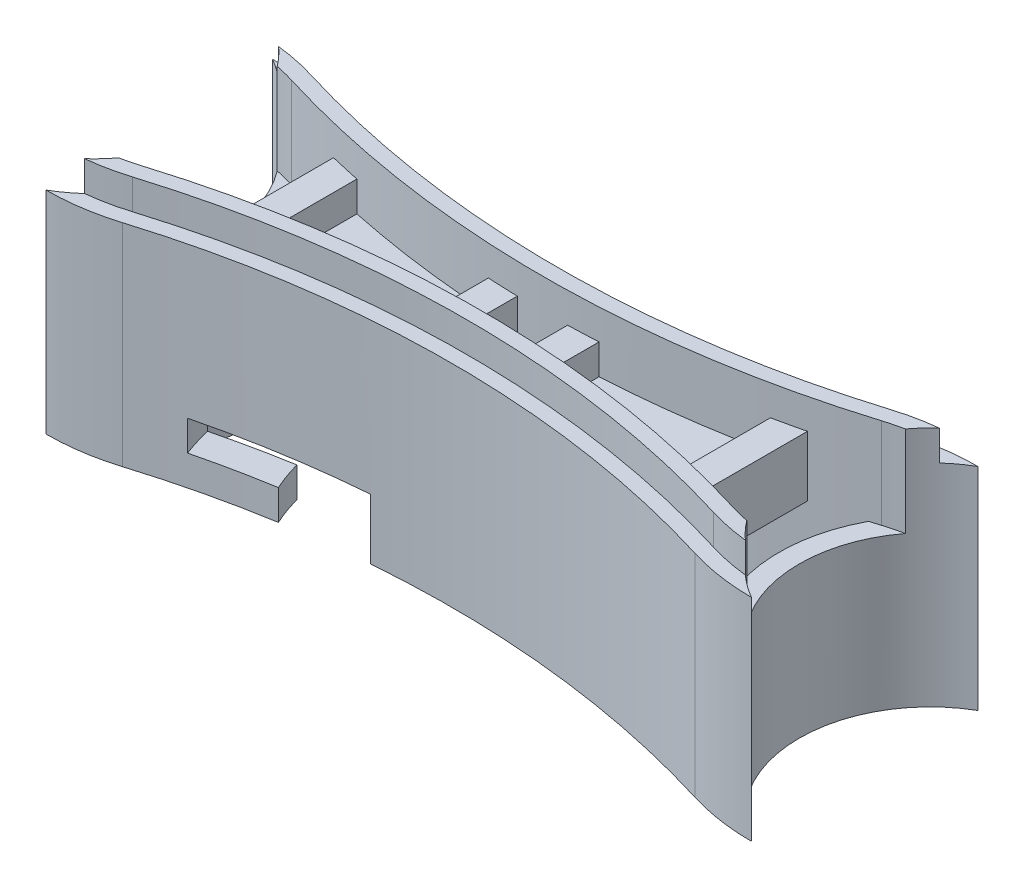
from build123d import *
from build123d.topology import SkipClean

# Parameters (mm, degrees)
BOSS_EXTRUDE1_DEPTH  = 3
BOSS_EXTRUDE2_DEPTH  = 3
CUT_EXTRUDE1_START   = -6
SKETCH5_R            = 13
CUT_EXTRUDE1_DEPTH   = 6
BOSS_EXTRUDE3_START  = 3
BOSS_EXTRUDE3_DEPTH  = 3
CUT_EXTRUDE2_START   = -3
CUT_EXTRUDE2_DEPTH   = 3
BOSS_EXTRUDE5_DEPTH  = 3
BOSS_EXTRUDE6_START  = 9
BOSS_EXTRUDE6_DEPTH  = 9
CUT_EXTRUDE3_START   = -9
CUT_EXTRUDE3_DEPTH   = 9
BOSS_EXTRUDE7_START  = 3
BOSS_EXTRUDE7_DEPTH  = 3
BOSS_EXTRUDE9_START  = 3
BOSS_EXTRUDE9_DEPTH  = 3
CUT_EXTRUDE4_DEPTH   = 3
BOSS_EXTRUDE10_DEPTH = 6
BOSS_EXTRUDE11_DEPTH = 6
CUT_EXTRUDE11_START  = -3
CUT_EXTRUDE11_DEPTH  = 3


with BuildPart() as part:
    # Sketch1 → Boss-Extrude1 (new body)
    with BuildSketch(Plane(origin=(0, 0, 0), x_dir=(1, 0, 0), z_dir=(0, 1, 0))):
        with BuildLine():
            ThreePointArc((-13.763919318, 73.266859581), (-33.263919318, 62.008529332), (-13.763919318, 50.750199082))
            ThreePointArc((-13.763919318, 50.750199082), (-9.005589068, 55.508529332), (-7.263919318, 62.008529332))
            ThreePointArc((-7.263919318, 62.008529332), (-9.005589068, 68.508529332), (-13.763919318, 73.266859581))
        make_face()
        with BuildLine():
            ThreePointArc((-13.763919318, 73.266859581), (-10.422992686, 73.017623928), (-7.156027114, 72.27543452))
            ThreePointArc((-7.156027114, 72.27543452), (21.283086066, 68.008529332), (49.722199247, 72.27543452))
            ThreePointArc((49.722199247, 72.27543452), (52.989164819, 73.017623928), (56.33009145, 73.266859581))
            ThreePointArc((56.33009145, 73.266859581), (49.83009145, 62.008529332), (56.33009145, 50.750199082))
            ThreePointArc((56.33009145, 50.750199082), (52.989164819, 50.999434735), (49.722199247, 51.741624144))
            ThreePointArc((49.722199247, 51.741624144), (21.283086066, 56.008529332), (-7.156027114, 51.741624144))
            ThreePointArc((-7.156027114, 51.741624144), (-10.422992686, 50.999434735), (-13.763919318, 50.750199082))
            ThreePointArc((-13.763919318, 50.750199082), (-7.263919318, 62.008529332), (-13.763919318, 73.266859581))
        make_face()
        with BuildLine():
            ThreePointArc((56.33009145, 73.266859581), (49.83009145, 62.008529332), (56.33009145, 50.750199082))
            ThreePointArc((56.33009145, 50.750199082), (69.33009145, 50.750199082), (75.83009145, 62.008529332))
            ThreePointArc((75.83009145, 62.008529332), (69.33009145, 73.266859581), (56.33009145, 73.266859581))
        make_face()
    extrude(amount=BOSS_EXTRUDE1_DEPTH)

    # Sketch3 → Boss-Extrude2 (add)
    with BuildSketch(Plane(origin=(0, 3, 0), x_dir=(1, 0, 0), z_dir=(0, 1, 0))):
        with BuildLine():
            ThreePointArc((-14.172730478, 71.762883155), (-31.763919318, 62.008529332), (-14.172730478, 52.254175508))
            ThreePointArc((-14.172730478, 52.254175508), (-10.84785642, 52.453484177), (-7.596227307, 53.175578044))
            ThreePointArc((-7.596227307, 53.175578044), (21.283086066, 57.508529332), (50.16239944, 53.175578044))
            ThreePointArc((50.16239944, 53.175578044), (53.414028553, 52.453484177), (56.73890261, 52.254175508))
            ThreePointArc((56.73890261, 52.254175508), (74.33009145, 62.008529332), (56.73890261, 71.762883155))
            ThreePointArc((56.73890261, 71.762883155), (53.414028553, 71.563574486), (50.16239944, 70.841480619))
            ThreePointArc((50.16239944, 70.841480619), (21.283086066, 66.508529332), (-7.596227307, 70.841480619))
            ThreePointArc((-7.596227307, 70.841480619), (-10.84785642, 71.563574486), (-14.172730478, 71.762883155))
        make_face()
        with BuildLine():
            ThreePointArc((-14.598703474, 70.248998338), (-30.263919318, 62.008529332), (-14.598703474, 53.768060325))
            ThreePointArc((-14.598703474, 53.768060325), (-11.28164905, 53.908699252), (-8.036427501, 54.609531945))
            ThreePointArc((-8.036427501, 54.609531945), (21.283086066, 59.008529332), (50.602599633, 54.609531945))
            ThreePointArc((50.602599633, 54.609531945), (53.847821182, 53.908699252), (57.164875607, 53.768060325))
            ThreePointArc((57.164875607, 53.768060325), (72.83009145, 62.008529332), (57.164875607, 70.248998338))
            ThreePointArc((57.164875607, 70.248998338), (53.847821182, 70.108359411), (50.602599633, 69.407526718))
            ThreePointArc((50.602599633, 69.407526718), (21.283086066, 65.008529332), (-8.036427501, 69.407526718))
            ThreePointArc((-8.036427501, 69.407526718), (-11.28164905, 70.108359411), (-14.598703474, 70.248998338))
        make_face(mode=Mode.SUBTRACT)
    extrude(amount=BOSS_EXTRUDE2_DEPTH)

    # Sketch5 → Cut-Extrude1 (cut)
    with BuildSketch(Plane(origin=(0, 6, 0), x_dir=(1, 0, 0), z_dir=(0, 1, 0)).offset(CUT_EXTRUDE1_START)):
        with Locations((-20.263919318, 62.008529332)):
            Circle(SKETCH5_R)
        with Locations((62.83009145, 62.008529332)):
            Circle(SKETCH5_R)
    extrude(amount=CUT_EXTRUDE1_DEPTH, mode=Mode.SUBTRACT)

    # Sketch6 → Boss-Extrude3 (add)
    with BuildSketch(Plane.XZ.offset(BOSS_EXTRUDE3_START)):
        with BuildLine():
            ThreePointArc((-7.156027114, -51.741624144), (-10.422992686, -50.999434735), (-13.763919318, -50.750199082))
            ThreePointArc((-13.763919318, -50.750199082), (-7.263919318, -62.008529332), (-13.763919318, -73.266859581))
            ThreePointArc((-13.763919318, -73.266859581), (-10.422992686, -73.017623928), (-7.156027114, -72.27543452))
            ThreePointArc((-7.156027114, -72.27543452), (21.283086066, -68.008529332), (49.722199247, -72.27543452))
            ThreePointArc((49.722199247, -72.27543452), (52.989164819, -73.017623928), (56.33009145, -73.266859581))
            ThreePointArc((56.33009145, -73.266859581), (49.83009145, -62.008529332), (56.33009145, -50.750199082))
            ThreePointArc((56.33009145, -50.750199082), (52.989164819, -50.999434735), (49.722199247, -51.741624144))
            ThreePointArc((49.722199247, -51.741624144), (21.283086066, -56.008529332), (-7.156027114, -51.741624144))
        make_face()
    extrude(amount=-BOSS_EXTRUDE3_DEPTH)

    # Sketch7 → Cut-Extrude2 (cut)
    with BuildSketch(Plane(origin=(0, 3, 0), x_dir=(1, 0, 0), z_dir=(0, 1, 0)).offset(CUT_EXTRUDE2_START)):
        with BuildLine():
            ThreePointArc((-9.921640975, 54.132154614), (-7.263919318, 62.008529332), (-9.921640975, 69.884904049))
            ThreePointArc((-9.921640975, 69.884904049), (-8.973084578, 69.669711219), (-8.036427501, 69.407526718))
            ThreePointArc((-8.036427501, 69.407526718), (21.283086066, 65.008529332), (50.602599633, 69.407526718))
            ThreePointArc((50.602599633, 69.407526718), (51.53925671, 69.669711219), (52.487813107, 69.884904049))
            ThreePointArc((52.487813107, 69.884904049), (49.83009145, 62.008529332), (52.487813107, 54.132154614))
            ThreePointArc((52.487813107, 54.132154614), (51.53925671, 54.347347444), (50.602599633, 54.609531945))
            ThreePointArc((50.602599633, 54.609531945), (21.283086066, 59.008529332), (-8.036427501, 54.609531945))
            ThreePointArc((-8.036427501, 54.609531945), (-8.973084578, 54.347347444), (-9.921640975, 54.132154614))
        make_face()
    extrude(amount=CUT_EXTRUDE2_DEPTH, mode=Mode.SUBTRACT)

    # Sketch8 → Boss-Extrude5 (add)
    with BuildSketch(Plane(origin=(0, 0, 0), x_dir=(1, 0, 0), z_dir=(0, 1, 0))):
        with BuildLine():
            ThreePointArc((0.736080682, 67.144209105), (-0.766531901, 67.472083585), (-2.263919318, 67.823049647))
            Line((-2.263919318, 67.823049647), (-2.263919318, 56.194009017))
            ThreePointArc((-2.263919318, 56.194009017), (-0.766531901, 56.544975078), (0.736080682, 56.872849558))
            Line((0.736080682, 56.872849558), (0.736080682, 67.144209105))
        make_face()
        with BuildLine():
            ThreePointArc((18.783086066, 65.039813184), (17.282634431, 65.088653668), (15.783086066, 65.160034347))
            Line((15.783086066, 65.160034347), (15.783086066, 58.857024316))
            ThreePointArc((15.783086066, 58.857024316), (17.282634431, 58.928404995), (18.783086066, 58.977245479))
            Line((18.783086066, 58.977245479), (18.783086066, 65.039813184))
        make_face()
        with BuildLine():
            ThreePointArc((26.783086066, 65.160034347), (25.283537701, 65.088653668), (23.783086066, 65.039813184))
            Line((23.783086066, 65.039813184), (23.783086066, 58.977245479))
            ThreePointArc((23.783086066, 58.977245479), (25.283537701, 58.928404995), (26.783086066, 58.857024316))
            Line((26.783086066, 58.857024316), (26.783086066, 65.160034347))
        make_face()
        with BuildLine():
            ThreePointArc((44.83009145, 67.823049647), (43.332704034, 67.472083585), (41.83009145, 67.144209105))
            Line((41.83009145, 67.144209105), (41.83009145, 56.872849558))
            ThreePointArc((41.83009145, 56.872849558), (43.332704034, 56.544975078), (44.83009145, 56.194009017))
            Line((44.83009145, 56.194009017), (44.83009145, 67.823049647))
        make_face()
    extrude(amount=BOSS_EXTRUDE5_DEPTH)

    # Sketch9 → Boss-Extrude6 (add)
    with SkipClean():  # the faces are left unmerged after this step: merging them gives an invalid solid
        with BuildSketch(Plane.XZ.offset(3).offset(BOSS_EXTRUDE6_START)):
            with BuildLine():
                ThreePointArc((-7.156027114, -51.741624144), (21.283086066, -56.008529332), (49.722199247, -51.741624144))
                ThreePointArc((49.722199247, -51.741624144), (52.989164819, -50.999434735), (56.33009145, -50.750199082))
                ThreePointArc((56.33009145, -50.750199082), (49.83009145, -62.008529332), (56.33009145, -73.266859581))
                ThreePointArc((56.33009145, -73.266859581), (52.989164819, -73.017623928), (49.722199247, -72.27543452))
                ThreePointArc((49.722199247, -72.27543452), (21.283086066, -68.008529332), (-7.156027114, -72.27543452))
                ThreePointArc((-7.156027114, -72.27543452), (-10.422992686, -73.017623928), (-13.763919318, -73.266859581))
                ThreePointArc((-13.763919318, -73.266859581), (-7.263919318, -62.008529332), (-13.763919318, -50.750199082))
                ThreePointArc((-13.763919318, -50.750199082), (-10.422992686, -50.999434735), (-7.156027114, -51.741624144))
            make_face()
            with BuildLine():
                ThreePointArc((-5.746204667, -55.282760877), (21.283086066, -59.008529332), (48.312376799, -55.282760877))
                ThreePointArc((48.312376799, -55.282760877), (46.83009145, -62.008529332), (48.312376799, -68.734297787))
                ThreePointArc((48.312376799, -68.734297787), (21.283086066, -65.008529332), (-5.746204667, -68.734297787))
                ThreePointArc((-5.746204667, -68.734297787), (-4.263919318, -62.008529332), (-5.746204667, -55.282760877))
            make_face(mode=Mode.SUBTRACT)
        extrude(amount=-BOSS_EXTRUDE6_DEPTH)

    # Sketch10 → Cut-Extrude3 (cut)
    with SkipClean():  # the faces are left unmerged after this step: merging them gives an invalid solid
        with BuildSketch(Plane(origin=(0, 0, 0), x_dir=(1, 0, 0), z_dir=(0, 1, 0)).offset(CUT_EXTRUDE3_START)):
            with BuildLine():
                Line((18.783086066, 65.039813184), (18.783086066, 58.977245479))
                ThreePointArc((18.783086066, 58.977245479), (21.283086066, 59.008529332), (23.783086066, 58.977245479))
                Line((23.783086066, 58.977245479), (23.783086066, 65.039813184))
                ThreePointArc((23.783086066, 65.039813184), (21.283086066, 65.008529332), (18.783086066, 65.039813184))
            make_face()
            with BuildLine():
                Line((44.83009145, 67.823049647), (44.83009145, 56.194009017))
                ThreePointArc((44.83009145, 56.194009017), (47.728215077, 55.445013132), (50.602599633, 54.609531945))
                ThreePointArc((50.602599633, 54.609531945), (51.53925671, 54.347347444), (52.487813107, 54.132154614))
                ThreePointArc((52.487813107, 54.132154614), (49.83009145, 62.008529332), (52.487813107, 69.884904049))
                ThreePointArc((52.487813107, 69.884904049), (51.53925671, 69.669711219), (50.602599633, 69.407526718))
                ThreePointArc((50.602599633, 69.407526718), (47.728215077, 68.572045531), (44.83009145, 67.823049647))
            make_face()
            with BuildLine():
                Line((-2.263919318, 56.194009017), (-2.263919318, 67.823049647))
                ThreePointArc((-2.263919318, 67.823049647), (-5.162042944, 68.572045531), (-8.036427501, 69.407526718))
                ThreePointArc((-8.036427501, 69.407526718), (-8.973084578, 69.669711219), (-9.921640975, 69.884904049))
                ThreePointArc((-9.921640975, 69.884904049), (-7.263919318, 62.008529332), (-9.921640975, 54.132154614))
                ThreePointArc((-9.921640975, 54.132154614), (-8.973084578, 54.347347444), (-8.036427501, 54.609531945))
                ThreePointArc((-8.036427501, 54.609531945), (-5.162042944, 55.445013132), (-2.263919318, 56.194009017))
            make_face()
        extrude(amount=CUT_EXTRUDE3_DEPTH, mode=Mode.SUBTRACT)

    # Sketch11 → Boss-Extrude7 (add)
    with SkipClean():  # the faces are left unmerged after this step: merging them gives an invalid solid
        with BuildSketch(Plane.XZ.offset(12).offset(BOSS_EXTRUDE7_START)):
            with BuildLine():
                ThreePointArc((56.33009145, -50.750199082), (52.989164819, -50.999434735), (49.722199247, -51.741624144))
                ThreePointArc((49.722199247, -51.741624144), (31.811586967, -55.434897445), (13.526037949, -55.697570252))
                ThreePointArc((13.526037949, -55.697570252), (12.590934614, -57.064188816), (11.894175682, -58.56638439))
                ThreePointArc((11.894175682, -58.56638439), (30.254780475, -58.604884532), (48.312376799, -55.282760877))
                ThreePointArc((48.312376799, -55.282760877), (46.83009145, -62.008529332), (48.312376799, -68.734297787))
                ThreePointArc((48.312376799, -68.734297787), (46.935876311, -68.358054802), (45.55414243, -68.001510476))
                ThreePointArc((45.55414243, -68.001510476), (45.150090936, -69.449367895), (44.659753587, -70.870324614))
                ThreePointArc((44.659753587, -70.870324614), (47.200500402, -71.538565767), (49.722199247, -72.27543452))
                ThreePointArc((49.722199247, -72.27543452), (52.989164819, -73.017623928), (56.33009145, -73.266859581))
                ThreePointArc((56.33009145, -73.266859581), (49.83009145, -62.008529332), (56.33009145, -50.750199082))
            make_face()
            with BuildLine():
                ThreePointArc((29.040134183, -68.319488412), (29.975237519, -66.952869847), (30.67199645, -65.450674273))
                ThreePointArc((30.67199645, -65.450674273), (12.311391658, -65.412174131), (-5.746204667, -68.734297787))
                ThreePointArc((-5.746204667, -68.734297787), (-4.263919318, -62.008529332), (-5.746204667, -55.282760877))
                ThreePointArc((-5.746204667, -55.282760877), (-4.369704179, -55.659003861), (-2.987970297, -56.015548187))
                ThreePointArc((-2.987970297, -56.015548187), (-2.583918804, -54.567690768), (-2.093581454, -53.146734049))
                ThreePointArc((-2.093581454, -53.146734049), (-4.63432827, -52.478492896), (-7.156027114, -51.741624144))
                ThreePointArc((-7.156027114, -51.741624144), (-10.422992686, -50.999434735), (-13.763919318, -50.750199082))
                ThreePointArc((-13.763919318, -50.750199082), (-7.263919318, -62.008529332), (-13.763919318, -73.266859581))
                ThreePointArc((-13.763919318, -73.266859581), (-10.422992686, -73.017623928), (-7.156027114, -72.27543452))
                ThreePointArc((-7.156027114, -72.27543452), (10.754585165, -68.582161219), (29.040134183, -68.319488412))
            make_face()
        extrude(amount=-BOSS_EXTRUDE7_DEPTH)

    # Sketch13 → Boss-Extrude9 (add)
    with SkipClean():  # the faces are left unmerged after this step: merging them gives an invalid solid
        with BuildSketch(Plane.XZ.offset(15).offset(BOSS_EXTRUDE9_START)):
            with BuildLine():
                ThreePointArc((56.33009145, -50.750199082), (49.83009145, -62.008529332), (56.33009145, -73.266859581))
                ThreePointArc((56.33009145, -73.266859581), (52.989164819, -73.017623928), (49.722199247, -72.27543452))
                ThreePointArc((49.722199247, -72.27543452), (21.283086066, -68.008529332), (-7.156027114, -72.27543452))
                ThreePointArc((-7.156027114, -72.27543452), (-10.422992686, -73.017623928), (-13.763919318, -73.266859581))
                ThreePointArc((-13.763919318, -73.266859581), (-7.263919318, -62.008529332), (-13.763919318, -50.750199082))
                ThreePointArc((-13.763919318, -50.750199082), (-10.422992686, -50.999434735), (-7.156027114, -51.741624144))
                ThreePointArc((-7.156027114, -51.741624144), (21.283086066, -56.008529332), (49.722199247, -51.741624144))
                ThreePointArc((49.722199247, -51.741624144), (52.989164819, -50.999434735), (56.33009145, -50.750199082))
            make_face()
            with BuildLine():
                ThreePointArc((48.312376799, -68.734297787), (21.283086066, -65.008529332), (-5.746204667, -68.734297787))
                ThreePointArc((-5.746204667, -68.734297787), (-4.263919318, -62.008529332), (-5.746204667, -55.282760877))
                ThreePointArc((-5.746204667, -55.282760877), (21.283086066, -59.008529332), (48.312376799, -55.282760877))
                ThreePointArc((48.312376799, -55.282760877), (46.83009145, -62.008529332), (48.312376799, -68.734297787))
            make_face(mode=Mode.SUBTRACT)
        extrude(amount=-BOSS_EXTRUDE9_DEPTH)

    # Sketch15 → Cut-Extrude4 (cut)
    with SkipClean():  # the faces are left unmerged after this step: merging them gives an invalid solid
        with BuildSketch(Plane.XZ.offset(18)):
            with BuildLine():
                ThreePointArc((29.040134183, -68.319488412), (33.121573027, -68.734359133), (37.181795412, -69.321602634))
                ThreePointArc((37.181795412, -69.321602634), (37.758137324, -67.909604324), (38.209354423, -66.452788496))
                ThreePointArc((38.209354423, -66.452788496), (34.450212414, -65.879999427), (30.67199645, -65.450674273))
                ThreePointArc((30.67199645, -65.450674273), (29.975237519, -66.952869847), (29.040134183, -68.319488412))
            make_face()
            with BuildLine():
                ThreePointArc((5.38437672, -54.695456029), (4.808034809, -56.107454339), (4.35681771, -57.564270167))
                ThreePointArc((4.35681771, -57.564270167), (8.115959718, -58.137059237), (11.894175682, -58.56638439))
                ThreePointArc((11.894175682, -58.56638439), (12.590934614, -57.064188816), (13.526037949, -55.697570252))
                ThreePointArc((13.526037949, -55.697570252), (9.444599106, -55.282699531), (5.38437672, -54.695456029))
            make_face()
        extrude(amount=-CUT_EXTRUDE4_DEPTH, mode=Mode.SUBTRACT)

    # Sketch16 → Boss-Extrude10 (add)
    with SkipClean():  # the faces are left unmerged after this step: merging them gives an invalid solid
        with BuildSketch(Plane.XZ.offset(18)):
            with BuildLine():
                ThreePointArc((23.783086066, -58.977245479), (21.283086066, -59.008529332), (18.783086066, -58.977245479))
                Line((18.783086066, -58.977245479), (18.783086066, -65.039813184))
                ThreePointArc((18.783086066, -65.039813184), (21.283086066, -65.008529332), (23.783086066, -65.039813184))
                Line((23.783086066, -65.039813184), (23.783086066, -58.977245479))
            make_face()
        extrude(amount=-BOSS_EXTRUDE10_DEPTH)

    # Sketch18 → Boss-Extrude11 (add)
    with SkipClean():  # the faces are left unmerged after this step: merging them gives an invalid solid
        with BuildSketch(Plane(origin=(0, -9, 0), x_dir=(1, 0, 0), z_dir=(0, 1, 0))):
            with BuildLine():
                ThreePointArc((50.602599633, 54.609531945), (49.459499, 54.952986792), (48.312376799, 55.282760877))
                ThreePointArc((48.312376799, 55.282760877), (46.83009145, 62.008529332), (48.312376799, 68.734297787))
                ThreePointArc((48.312376799, 68.734297787), (49.459499, 69.064071871), (50.602599633, 69.407526718))
                ThreePointArc((50.602599633, 69.407526718), (51.53925671, 69.669711219), (52.487813107, 69.884904049))
                ThreePointArc((52.487813107, 69.884904049), (49.83009145, 62.008529332), (52.487813107, 54.132154614))
                ThreePointArc((52.487813107, 54.132154614), (51.53925671, 54.347347444), (50.602599633, 54.609531945))
            make_face()
            with BuildLine():
                ThreePointArc((-8.036427501, 69.407526718), (-6.893326867, 69.064071871), (-5.746204667, 68.734297787))
                ThreePointArc((-5.746204667, 68.734297787), (-4.263919318, 62.008529332), (-5.746204667, 55.282760877))
                ThreePointArc((-5.746204667, 55.282760877), (-6.893326867, 54.952986792), (-8.036427501, 54.609531945))
                ThreePointArc((-8.036427501, 54.609531945), (-8.973084578, 54.347347444), (-9.921640975, 54.132154614))
                ThreePointArc((-9.921640975, 54.132154614), (-7.263919318, 62.008529332), (-9.921640975, 69.884904049))
                ThreePointArc((-9.921640975, 69.884904049), (-8.973084578, 69.669711219), (-8.036427501, 69.407526718))
            make_face()
        extrude(amount=BOSS_EXTRUDE11_DEPTH)

    # Sketch21 → Cut-Extrude11 (cut)
    with SkipClean():  # the faces are left unmerged after this step: merging them gives an invalid solid
        with BuildSketch(Plane(origin=(0, -3, 0), x_dir=(1, 0, 0), z_dir=(0, 1, 0)).offset(CUT_EXTRUDE11_START)):
            with BuildLine():
                ThreePointArc((48.312376799, 68.734297787), (46.83009145, 62.008529332), (48.312376799, 55.282760877))
                ThreePointArc((48.312376799, 55.282760877), (48.965867006, 55.096714934), (49.618076833, 54.906229016))
                ThreePointArc((49.618076833, 54.906229016), (47.83009145, 62.008529332), (49.618076833, 69.110829647))
                ThreePointArc((49.618076833, 69.110829647), (48.965867006, 68.92034373), (48.312376799, 68.734297787))
            make_face()
            with BuildLine():
                ThreePointArc((-5.746204667, 68.734297787), (-6.399694874, 68.92034373), (-7.051904701, 69.110829647))
                ThreePointArc((-7.051904701, 69.110829647), (-5.263919318, 62.008529332), (-7.051904701, 54.906229016))
                ThreePointArc((-7.051904701, 54.906229016), (-6.399694874, 55.096714934), (-5.746204667, 55.282760877))
                ThreePointArc((-5.746204667, 55.282760877), (-4.263919318, 62.008529332), (-5.746204667, 68.734297787))
            make_face()
        extrude(amount=CUT_EXTRUDE11_DEPTH, mode=Mode.SUBTRACT)


solid = part.part
